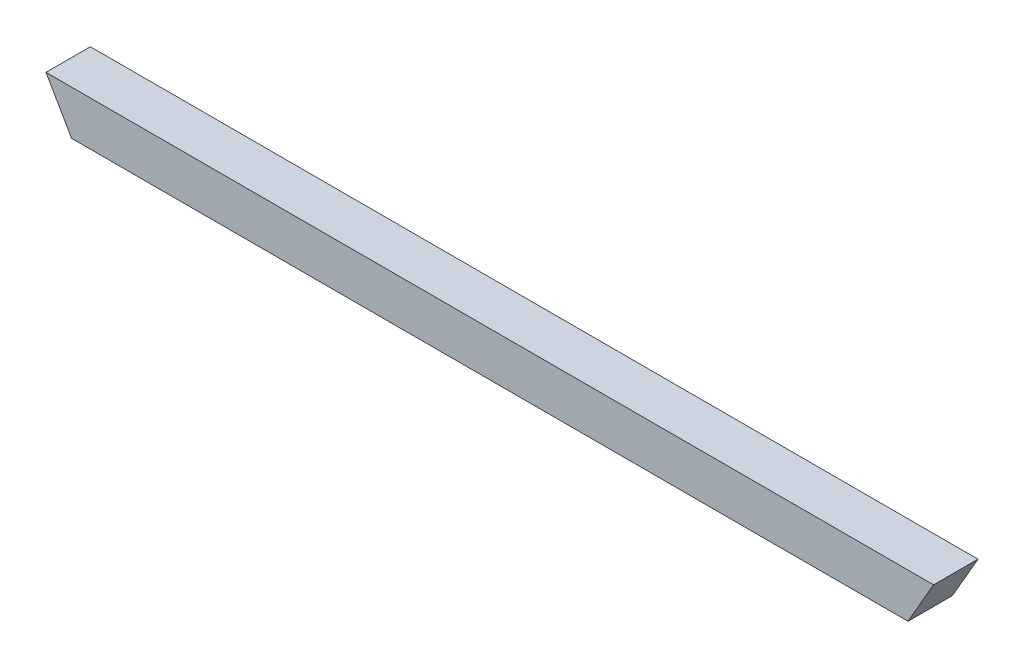
from build123d import *

# Parameters (mm, degrees)
BOSS_EXTRUDE1_DEPTH = 20


with BuildPart() as part:
    # Sketch2 → Boss-Extrude1 (new body)
    with BuildSketch(Plane.XY):
        Polygon((-200, 0), (200, 0), (188.452994616, -20), (-188.452994616, -20), align=None)
    extrude(amount=BOSS_EXTRUDE1_DEPTH)


solid = part.part
